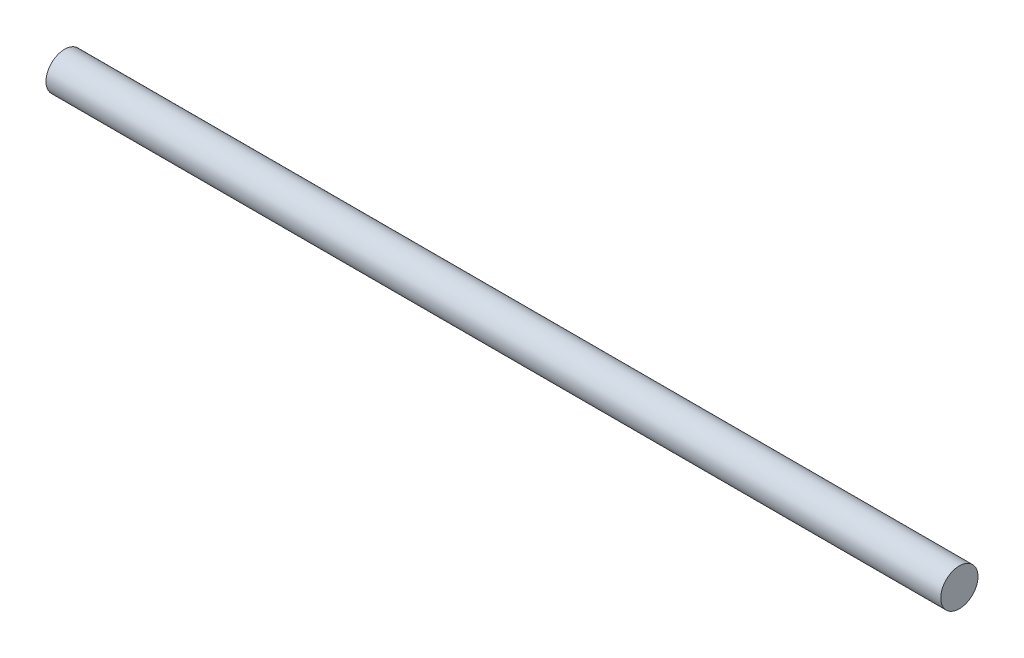
from build123d import *

# Parameters (mm, degrees)
SKETCH1_R           = 1.25
BOSS_EXTRUDE1_DEPTH = 60


with BuildPart() as part:
    # Sketch1 → Boss-Extrude1 (new body)
    with BuildSketch(Plane(origin=(0, 0, 0), x_dir=(0, 0, -1), z_dir=(1, 0, 0))):
        Circle(SKETCH1_R)
    extrude(amount=BOSS_EXTRUDE1_DEPTH)


solid = part.part
